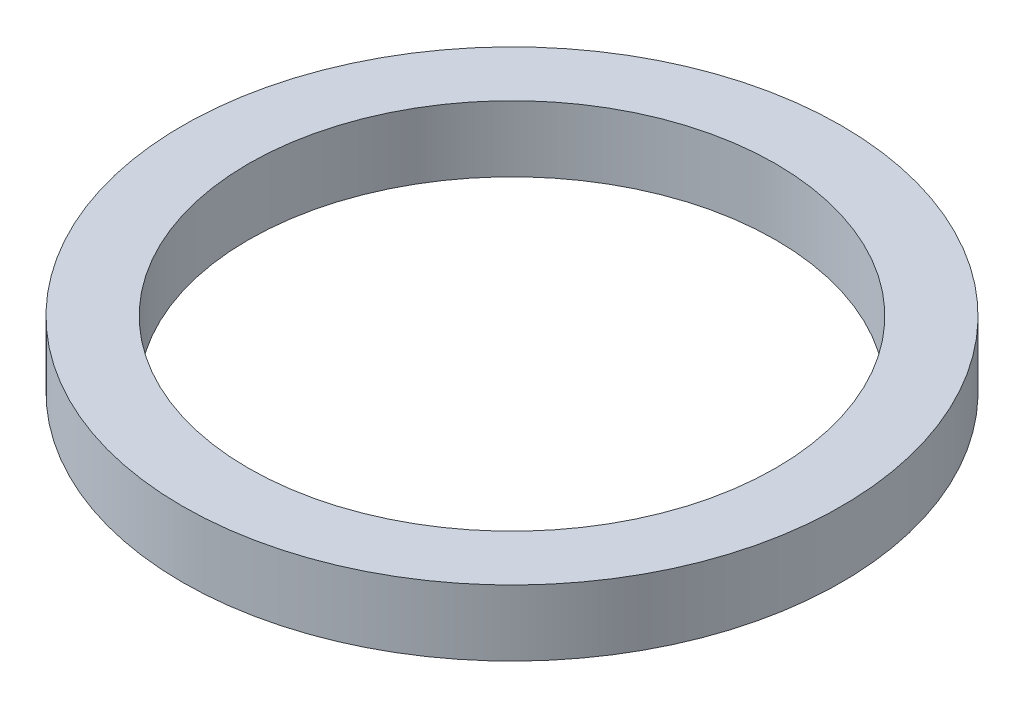
from build123d import *

# Parameters (mm, degrees)
SKETCH_1_R      = 25
SKETCH_1_R_2    = 20
EXTRUDE_1_DEPTH = 5


with BuildPart() as part:
    # 草图1 → 凸台-拉伸1 (new body)
    with BuildSketch(Plane(origin=(0, 0, 0), x_dir=(1, 0, 0), z_dir=(0, 1, 0))):
        with Locations(Location((0, 0, 0), (0, 0, 270))):
            Circle(SKETCH_1_R)
        with Locations(Location((0, 0, 0), (0, 0, 270))):
            Circle(SKETCH_1_R_2, mode=Mode.SUBTRACT)
    extrude(amount=EXTRUDE_1_DEPTH)


solid = part.part
